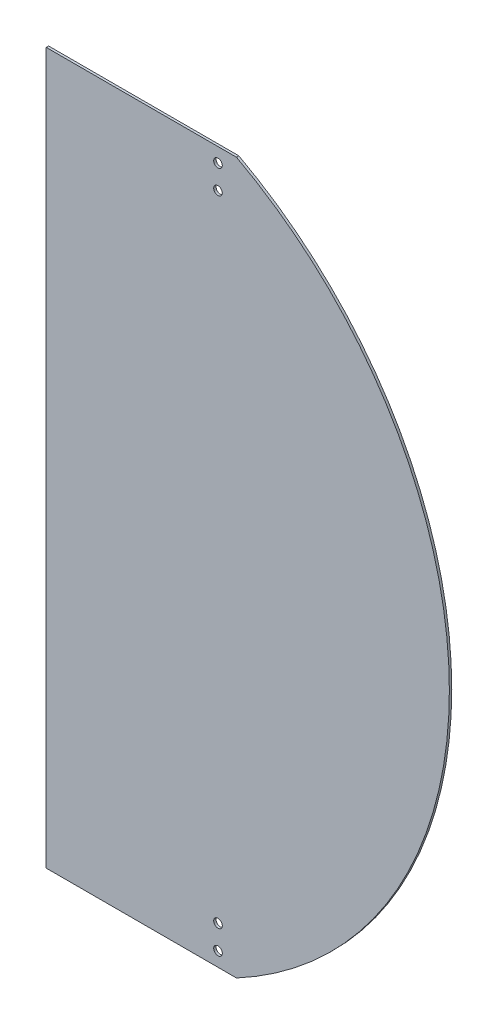
from build123d import *

# Parameters (mm, degrees)
BOSS_EXTRUDE1_DEPTH = 2.5
SKETCH3_R           = 4.5
CUT_EXTRUDE1_DEPTH  = 564.266144908


with BuildPart() as part:
    # Sketch2 → Boss-Extrude1 (new body)
    with BuildSketch(Plane.XY):
        with BuildLine():
            Line((0, 372.5), (0, -372.5))
            Line((0, -372.5), (199.374020374, -372.5))
            ThreePointArc((199.374020374, -372.5), (422.5, 0), (199.374020374, 372.5))
            Line((199.374020374, 372.5), (0, 372.5))
        make_face()
    extrude(amount=BOSS_EXTRUDE1_DEPTH)

    # Sketch3 → Cut-Extrude1 (cut, symmetric)
    with BuildSketch(Plane(origin=(0, 0, 0), x_dir=(-1, 0, 0), z_dir=(0, 0, -1))):
        with Locations((-180, 357.5)):
            Circle(SKETCH3_R)
        with Locations((-180, 332.5)):
            Circle(SKETCH3_R)
    cut_extrude1 = extrude(amount=CUT_EXTRUDE1_DEPTH, both=True, mode=Mode.SUBTRACT)

    # Mirror1: Cut-Extrude1 across plane
    add(cut_extrude1.mirror(Plane.ZX), mode=Mode.SUBTRACT)


solid = part.part
